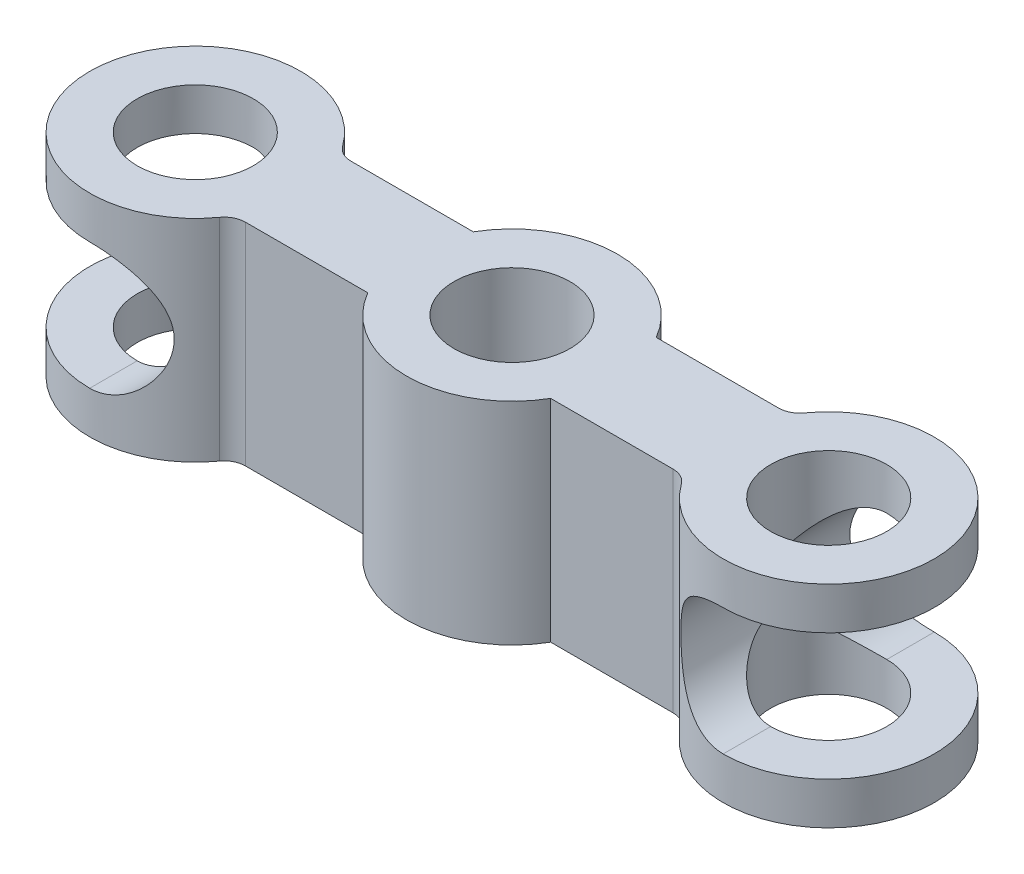
from build123d import *

# Parameters (mm, degrees)
SKETCH1_W            = 15
SKETCH1_H            = 5
BOSS_EXTRUDE1_DEPTH  = 10
SKETCH2_R            = 5
BOSS_EXTRUDE2_DEPTH  = 10
CUT_EXTRUDE1_REACH   = 20.708
SKETCH3_R            = 2.75
CUT_EXTRUDE2_DEPTH   = 19.708286934
FILLET1_R            = 1
FILLET1_OF_MIRROR1_R = 1
SKETCH6_R            = 5
BOSS_EXTRUDE3_DEPTH  = 10
SKETCH7_R            = 2.75
CUT_EXTRUDE3_DEPTH   = 10


with BuildPart() as part:
    # Sketch1 → Boss-Extrude1 (new body)
    with BuildSketch(Plane(origin=(0, 0, 0), x_dir=(1, 0, 0), z_dir=(0, 1, 0))):
        with Locations((7.5, 0)):
            Rectangle(SKETCH1_W, SKETCH1_H)
    boss_extrude1 = extrude(amount=BOSS_EXTRUDE1_DEPTH)

    # Sketch2 → Boss-Extrude2 (add)
    with BuildSketch(Plane(origin=(0, 0, 0), x_dir=(1, 0, 0), z_dir=(0, 1, 0))):
        Circle(SKETCH2_R)
    boss_extrude2 = extrude(amount=BOSS_EXTRUDE2_DEPTH)

    # Sketch3 → Cut-Extrude1 (cut, up to next)
    with BuildSketch(Plane(origin=(0, 0, 0), x_dir=(1, 0, 0), z_dir=(0, 1, 0)), mode=Mode.PRIVATE) as cut_extrude1_sk1:
        with Locations(Location((0, 0, 0), (0, 0, 270))):
            Circle(SKETCH3_R)
    cut_extrude1_tool1 = extrude(cut_extrude1_sk1.sketch, amount=CUT_EXTRUDE1_REACH, mode=Mode.PRIVATE) & part.part
    cut_extrude1 = cut_extrude1_tool1.solids().sort_by_distance((0, 0, 0))[0]
    add(cut_extrude1, mode=Mode.SUBTRACT)

    # Sketch4 → Cut-Extrude2 (cut, symmetric)
    with BuildSketch(Plane.XY):
        with BuildLine():
            Line((0, 8), (-5, 8))
            Line((-5, 8), (-5, 2))
            Line((-5, 2), (0, 2))
            ThreePointArc((0, 2), (3, 5), (0, 8))
        make_face()
    cut_extrude2 = extrude(amount=CUT_EXTRUDE2_DEPTH, both=True, mode=Mode.SUBTRACT)

    # Fillet1
    fillet1_edges = [part.edges().sort_by_distance(p)[0] for p in [
        (4.330127019, 5, 2.5),
        (4.330127019, 5, -2.5),
    ]]
    fillet(fillet1_edges, radius=FILLET1_R)

    # Mirror1: Boss-Extrude1, Boss-Extrude2, Cut-Extrude1, Cut-Extrude2 across plane
    add(boss_extrude1.mirror(Plane(origin=(15, 10, -2.5), x_dir=(0, 0, 1), z_dir=(-1, 0, 0))))
    add(boss_extrude2.mirror(Plane(origin=(15, 10, -2.5), x_dir=(0, 0, 1), z_dir=(-1, 0, 0))))
    add(cut_extrude1.mirror(Plane(origin=(15, 10, -2.5), x_dir=(0, 0, 1), z_dir=(-1, 0, 0))), mode=Mode.SUBTRACT)
    add(cut_extrude2.mirror(Plane(origin=(15, 10, -2.5), x_dir=(0, 0, 1), z_dir=(-1, 0, 0))), mode=Mode.SUBTRACT)

    # Fillet1 of Mirror1
    fillet1_of_mirror1_edges = [part.edges().sort_by_distance(p)[0] for p in [
        (25.669872981, 5, 2.5),
        (25.669872981, 5, -2.5),
    ]]
    fillet(fillet1_of_mirror1_edges, radius=FILLET1_OF_MIRROR1_R)

    # Sketch6 → Boss-Extrude3 (add)
    with BuildSketch(Plane(origin=(0, 0, 0), x_dir=(1, 0, 0), z_dir=(0, 1, 0))):
        with Locations((15, 0)):
            Circle(SKETCH6_R)
    extrude(amount=BOSS_EXTRUDE3_DEPTH)

    # Sketch7 → Cut-Extrude3 (cut)
    with BuildSketch(Plane(origin=(0, 0, 0), x_dir=(1, 0, 0), z_dir=(0, 1, 0))):
        with Locations(Location((15, 0, 0), (0, 0, 270))):
            Circle(SKETCH7_R)
    extrude(amount=CUT_EXTRUDE3_DEPTH, mode=Mode.SUBTRACT)


solid = part.part
